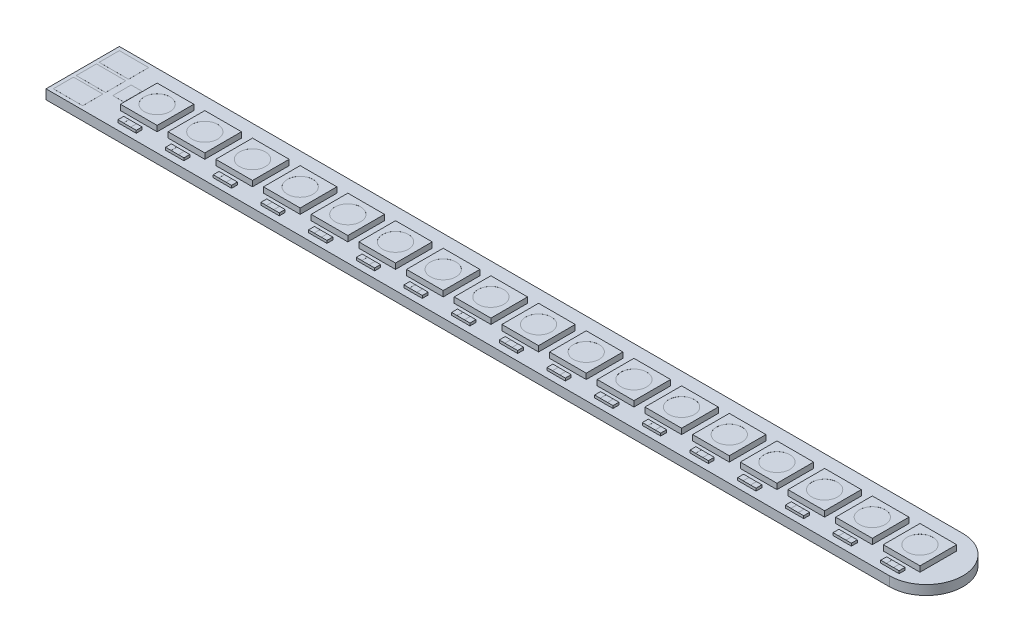
from build123d import *

# Parameters (mm, degrees)
PCB_DEPTH               = 0.65
SKETCH2_3_W             = 4
SKETCH2_3_H             = 2.75
CONTACTS_DEPTH          = 0.655
SKETCH2_4_W             = 1.5
SKETCH2_4_H             = 2.5
DATALINE_RESISTOR_DEPTH = 0.655
SKETCH2_5_W             = 5
SKETCH2_5_H             = 5
SKETCH2_5_R             = 1.75
BOSS_EXTRUDE5_DEPTH     = 1.405
SKETCH2_6_R             = 1.75
BOSS_EXTRUDE6_DEPTH     = 1.4
SKETCH2_7_W             = 0.75
SKETCH2_7_H             = 0.8
BOSS_EXTRUDE7_DEPTH     = 1
SKETCH2_8_W             = 1
SKETCH2_8_H             = 0.8
BOSS_EXTRUDE8_DEPTH     = 0.995
LPATTERN1_COUNT         = 17
LPATTERN1_PITCH         = 6.5
SKETCH3_R               = 0.25
CUT_EXTRUDE3_DEPTH      = 10


with BuildPart() as part:
    # Sketch2 → PCB (new, symmetric)
    with BuildSketch(Plane(origin=(0, 0, 0), x_dir=(1, 0, 0), z_dir=(0, 1, 0))):
        with BuildLine():
            ThreePointArc((55, -5), (60, 0), (55, 5))
            Line((55, 5), (-60, 5))
            Line((-60, 5), (-60, -5))
            Line((-60, -5), (55, -5))
        make_face()
    extrude(amount=PCB_DEPTH, both=True)

    # Sketch2<3> → Contacts (add, symmetric)
    with BuildSketch(Plane(origin=(0, 0, 0), x_dir=(1, 0, 0), z_dir=(0, 1, 0))):
        with Locations((-57.5, 3.125)):
            Rectangle(SKETCH2_3_W, SKETCH2_3_H)
        with Locations((-57.5, 0)):
            Rectangle(SKETCH2_3_W, SKETCH2_3_H)
        with Locations((-57.5, -3.125)):
            Rectangle(SKETCH2_3_W, SKETCH2_3_H)
    extrude(amount=CONTACTS_DEPTH, both=True)

    # Sketch2<4> → Dataline Resistor (add, symmetric)
    with BuildSketch(Plane(origin=(0, 0, 0), x_dir=(1, 0, 0), z_dir=(0, 1, 0))):
        with Locations((-53.89, 0)):
            Rectangle(SKETCH2_4_W, SKETCH2_4_H)
    extrude(amount=DATALINE_RESISTOR_DEPTH, both=True)

    # Sketch2<5> → Boss-Extrude5 (add, symmetric)
    with BuildSketch(Plane(origin=(0, 0, 0), x_dir=(1, 0, 0), z_dir=(0, 1, 0))):
        with Locations((-49.85, 0)):
            Rectangle(SKETCH2_5_W, SKETCH2_5_H)
        with Locations((-49.85, 0)):
            Circle(SKETCH2_5_R, mode=Mode.SUBTRACT)
    boss_extrude5 = extrude(amount=BOSS_EXTRUDE5_DEPTH, both=True)

    # Sketch2<6> → Boss-Extrude6 (add, symmetric)
    with BuildSketch(Plane(origin=(0, 0, 0), x_dir=(1, 0, 0), z_dir=(0, 1, 0))):
        with Locations((-49.85, 0)):
            Circle(SKETCH2_6_R)
    boss_extrude6 = extrude(amount=BOSS_EXTRUDE6_DEPTH, both=True)

    # Sketch2<7> → Boss-Extrude7 (add, symmetric)
    with BuildSketch(Plane(origin=(0, 0, 0), x_dir=(1, 0, 0), z_dir=(0, 1, 0))):
        with Locations((-50.725, -3.7)):
            Rectangle(SKETCH2_7_W, SKETCH2_7_H)
        with Locations((-48.975, -3.7)):
            Rectangle(SKETCH2_7_W, SKETCH2_7_H)
    boss_extrude7 = extrude(amount=BOSS_EXTRUDE7_DEPTH, both=True)

    # Sketch2<8> → Boss-Extrude8 (add, symmetric)
    with BuildSketch(Plane(origin=(0, 0, 0), x_dir=(1, 0, 0), z_dir=(0, 1, 0))):
        with Locations((-49.85, -3.7)):
            Rectangle(SKETCH2_8_W, SKETCH2_8_H)
    boss_extrude8 = extrude(amount=BOSS_EXTRUDE8_DEPTH, both=True)

    # LPattern1: Boss-Extrude5, Boss-Extrude6, Boss-Extrude7, Boss-Extrude8 ×17
    with Locations(*[(i * LPATTERN1_PITCH, 0, 0) for i in range(1, LPATTERN1_COUNT)]):
        add(boss_extrude5)
        add(boss_extrude6)
        add(boss_extrude7)
        add(boss_extrude8)

    # Sketch3 → Cut-Extrude3 (cut)
    with BuildSketch(Plane.ZY.offset(60)):
        Circle(SKETCH3_R)
    extrude(amount=-CUT_EXTRUDE3_DEPTH, mode=Mode.SUBTRACT)


solid = part.part
